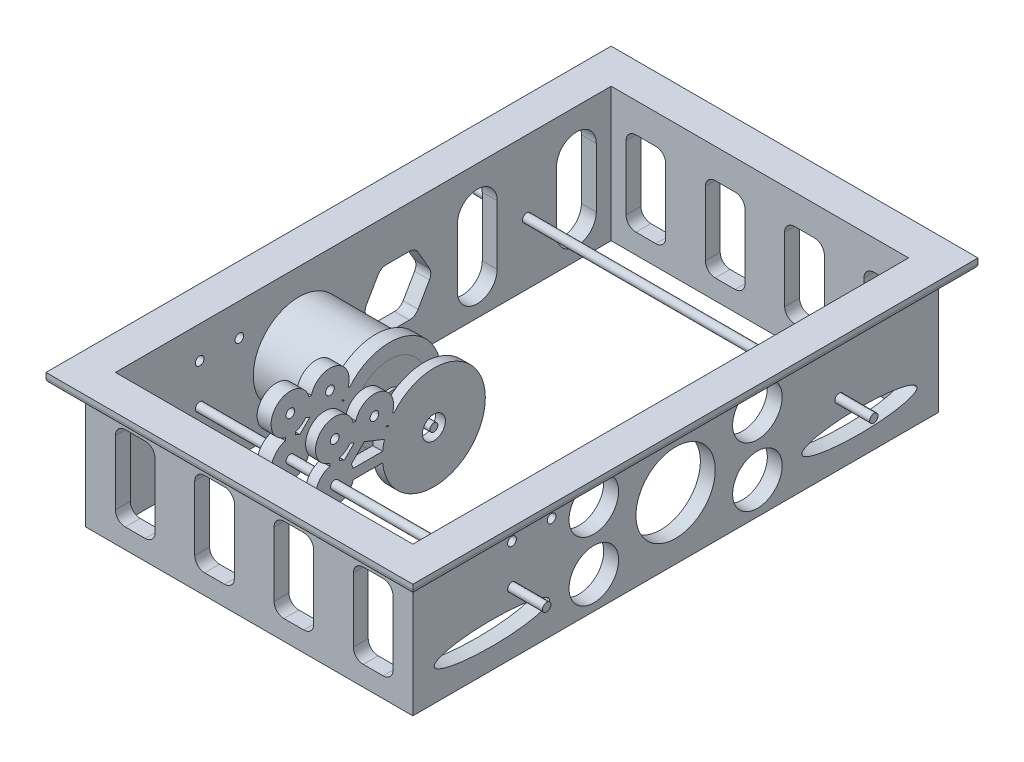
from build123d import *

# Parameters (mm, degrees)
SKETCH3_W             = 83.82
SKETCH3_H             = 134.62
SKETCH3_W_2           = 76.2
SKETCH3_H_2           = 127
EXTRUDE_THIN1_DEPTH   = 31.75
SKETCH6_R             = 1.1176
CUT_EXTRUDE1_DEPTH    = 159.57210032
SKETCH7_R             = 1.0795
BOSS_EXTRUDE1_DEPTH   = 50.8
BOSS_EXTRUDE1_2_DEPTH = 50.8
SKETCH9_R             = 11.6713
CUT_EXTRUDE2_DEPTH    = 3.81
SKETCH11_R            = 11.6713
BOSS_EXTRUDE2_DEPTH   = 23.4442
SKETCH12_R            = 9.3726
BOSS_EXTRUDE3_DEPTH   = 3.5814
SKETCH13_R            = 2.9464
BOSS_EXTRUDE4_DEPTH   = 0.7366
SKETCH14_R            = 1.0287
BOSS_EXTRUDE5_DEPTH   = 10.6426
SKETCH16_R            = 1.0795
SKETCH16_R_2          = 9.3726
SKETCH16_R_3          = 1.1176
BOSS_EXTRUDE6_DEPTH   = 3.5814
SKETCH17_R            = 1.1176
CUT_EXTRUDE3_DEPTH    = 164.445595536
SKETCH19_R            = 2.9464
SKETCH19_R_2          = 1.0795
SKETCH19_R_3          = 1.1176
BOSS_EXTRUDE7_DEPTH   = 2.54
SKETCH20_R            = 10.16
SKETCH20_R_2          = 6.35
SKETCH20_RX           = 14.75866049
SKETCH20_RY           = 2.956893509
CUT_EXTRUDE4_DEPTH    = 3.81
CUT_EXTRUDE5_DEPTH    = 3.81
SKETCH22_W            = 10.16
SKETCH22_H            = 21.59
CUT_EXTRUDE6_DEPTH    = 3.81
SKETCH24_W            = 93.98
SKETCH24_H            = 144.78
SKETCH24_W_2          = 76.2
SKETCH24_H_2          = 127
BOSS_EXTRUDE9_DEPTH   = 2.54
FILLET1_R             = 2.54
FILLET2_R             = 1.27


with BuildPart() as part:
    # Sketch3 → Extrude-Thin1 (new body)
    with BuildSketch(Plane(origin=(0, 0, 0), x_dir=(1, 0, 0), z_dir=(0, 1, 0))):
        with Locations((38.1, 63.5)):
            Rectangle(SKETCH3_W, SKETCH3_H)
        with Locations((38.1, 63.5)):
            Rectangle(SKETCH3_W_2, SKETCH3_H_2, mode=Mode.SUBTRACT)
    extrude(amount=EXTRUDE_THIN1_DEPTH)

    # Sketch6 → Cut-Extrude1 (cut, through all)
    with BuildSketch(Plane.ZY.offset(3.81)):
        with Locations((-21.59, 15.875)):
            Circle(SKETCH6_R)
        with Locations((-105.41, 15.875)):
            Circle(SKETCH6_R)
    extrude(amount=-CUT_EXTRUDE1_DEPTH, mode=Mode.SUBTRACT)

    # Sketch9 → Cut-Extrude2 (cut)
    with BuildSketch(Plane.ZY.offset(3.81)):
        with Locations((-46.99, 15.875)):
            Circle(SKETCH9_R)
    extrude(amount=-CUT_EXTRUDE2_DEPTH, mode=Mode.SUBTRACT)

    # Sketch17 → Cut-Extrude3 (cut, through all)
    with BuildSketch(Plane(origin=(80.01, 0, 0), x_dir=(0, 0, -1), z_dir=(1, 0, 0))):
        with Locations((21.59, 26.035)):
            Circle(SKETCH17_R)
        with Locations((31.75, 26.035)):
            Circle(SKETCH17_R)
    extrude(amount=-CUT_EXTRUDE3_DEPTH, mode=Mode.SUBTRACT)

    # Sketch20 → Cut-Extrude4 (cut)
    with BuildSketch(Plane(origin=(80.01, 0, 0), x_dir=(0, 0, -1), z_dir=(1, 0, 0))):
        with Locations((63.5, 15.875)):
            Circle(SKETCH20_R)
        with Locations((84.455, 23.495)):
            Circle(SKETCH20_R_2)
        with Locations(Location((42.545, 23.495, 0), (0, 0, 180))):
            Circle(SKETCH20_R_2)
        with Locations((42.545, 8.255)):
            Circle(SKETCH20_R_2)
        with Locations(Location((84.455, 8.255, 0), (0, 0, 180))):
            Circle(SKETCH20_R_2)
        with Locations((16.421244345, 8.255)):
            Ellipse(SKETCH20_RX, SKETCH20_RY)
        with Locations(Location((110.578755655, 8.255), (0, 0, -180))):
            Ellipse(SKETCH20_RX, SKETCH20_RY)
    extrude(amount=-CUT_EXTRUDE4_DEPTH, mode=Mode.SUBTRACT)

    # Sketch21 → Cut-Extrude5 (cut)
    with BuildSketch(Plane.ZY.offset(3.81)):
        with BuildLine():
            Line((-123.19, 8.255), (-123.19, 23.495))
            ThreePointArc((-123.19, 23.495), (-118.11, 28.575), (-113.03, 23.495))
            Line((-113.03, 23.495), (-113.03, 8.255))
            ThreePointArc((-113.03, 8.255), (-118.11, 3.175), (-123.19, 8.255))
        make_face()
        with BuildLine():
            Line((-87.63, 8.255), (-87.63, 23.495))
            ThreePointArc((-87.63, 23.495), (-92.71, 28.575), (-97.79, 23.495))
            Line((-97.79, 23.495), (-97.79, 8.255))
            ThreePointArc((-97.79, 8.255), (-92.71, 3.175), (-87.63, 8.255))
        make_face()
        Polygon((-67.990590949, 23.495), (-76.789409051, 23.495), (-81.188818102, 15.875), (-76.789409051, 8.255), (-67.990590949, 8.255), (-63.591181898, 15.875), align=None)
    extrude(amount=-CUT_EXTRUDE5_DEPTH, mode=Mode.SUBTRACT)

    # Sketch22 → Cut-Extrude6 (cut)
    with BuildSketch(Plane(origin=(0, 0, -130.81), x_dir=(-1, 0, 0), z_dir=(0, 0, -1))):
        with Locations((-69.85, 15.875)):
            Rectangle(SKETCH22_W, SKETCH22_H)
        with Locations((-49.53, 15.875)):
            Rectangle(SKETCH22_W, SKETCH22_H)
        with Locations((-29.21, 15.875)):
            Rectangle(SKETCH22_W, SKETCH22_H)
        with Locations((-8.89, 15.875)):
            Rectangle(SKETCH22_W, SKETCH22_H)
    cut_extrude6 = extrude(amount=-CUT_EXTRUDE6_DEPTH, mode=Mode.SUBTRACT)

    # Mirror2: Cut-Extrude6 across plane
    add(cut_extrude6.mirror(Plane(origin=(0, 0, -63.5), x_dir=(1, 0, 0), z_dir=(0, 0, -1))), mode=Mode.SUBTRACT)

    # Sketch24 → Boss-Extrude9 (add)
    with BuildSketch(Plane(origin=(0, 31.75, 0), x_dir=(1, 0, 0), z_dir=(0, 1, 0))):
        with Locations((38.1, 63.5)):
            Rectangle(SKETCH24_W, SKETCH24_H)
        with Locations((38.1, 63.5)):
            Rectangle(SKETCH24_W_2, SKETCH24_H_2, mode=Mode.SUBTRACT)
    extrude(amount=BOSS_EXTRUDE9_DEPTH)

    # Fillet1
    fillet1_edges = [part.edges().sort_by_distance(p)[0] for p in [
        (80.01, 31.75, -63.5),
        (-1.905, 8.255, -76.789409051),
        (-1.905, 15.875, -81.188818102),
        (-1.905, 23.495, -67.990590949),
        (-1.905, 15.875, -63.591181898),
        (-1.905, 8.255, -67.990590949),
        (-1.905, 23.495, -76.789409051),
        (38.1, 31.75, -130.81),
        (64.77, 26.67, -128.905),
        (74.93, 26.67, -128.905),
        (74.93, 5.08, -128.905),
        (64.77, 5.08, -128.905),
        (44.45, 26.67, -128.905),
        (54.61, 26.67, -128.905),
        (54.61, 5.08, -128.905),
        (44.45, 5.08, -128.905),
        (24.13, 26.67, -128.905),
        (34.29, 26.67, -128.905),
        (34.29, 5.08, -128.905),
        (24.13, 5.08, -128.905),
        (3.81, 26.67, -128.905),
        (13.97, 26.67, -128.905),
        (13.97, 5.08, -128.905),
        (3.81, 5.08, -128.905),
        (74.93, 5.08, 1.905),
        (64.77, 5.08, 1.905),
        (64.77, 26.67, 1.905),
        (74.93, 26.67, 1.905),
        (54.61, 5.08, 1.905),
        (44.45, 5.08, 1.905),
        (44.45, 26.67, 1.905),
        (54.61, 26.67, 1.905),
        (34.29, 5.08, 1.905),
        (24.13, 5.08, 1.905),
        (24.13, 26.67, 1.905),
        (34.29, 26.67, 1.905),
        (13.97, 5.08, 1.905),
        (3.81, 5.08, 1.905),
        (3.81, 26.67, 1.905),
        (13.97, 26.67, 1.905),
        (-3.81, 31.75, -63.5),
        (38.1, 31.75, 3.81),
    ]]
    fillet(fillet1_edges, radius=FILLET1_R)

    # Fillet2
    fillet2_edges = [part.edges().sort_by_distance(p)[0] for p in [
        (-8.89, 31.75, -63.5),
        (38.1, 31.75, 8.89),
        (85.09, 31.75, -63.5),
        (38.1, 31.75, -135.89),
    ]]
    fillet(fillet2_edges, radius=FILLET2_R)


with BuildPart() as body_2:
    # Sketch7 → Boss-Extrude1 (new, symmetric)
    with BuildSketch(Plane.ZY.offset(-38.1)):
        with Locations((-21.59, 15.875)):
            Circle(SKETCH7_R)
    extrude(amount=BOSS_EXTRUDE1_DEPTH, both=True)


with BuildPart() as body_3:
    # Sketch7 → Boss-Extrude1 2 (new, symmetric)
    with BuildSketch(Plane.ZY.offset(-38.1)):
        with Locations((-105.41, 15.875)):
            Circle(SKETCH7_R)
    extrude(amount=BOSS_EXTRUDE1_2_DEPTH, both=True)


with BuildPart() as body_4:
    # Sketch11 → Boss-Extrude2 (new body)
    with BuildSketch(Plane.ZY.offset(3.81)):
        with Locations((-46.99, 15.875)):
            Circle(SKETCH11_R)
    extrude(amount=-BOSS_EXTRUDE2_DEPTH)

    # Sketch12 → Boss-Extrude3 (add)
    with BuildSketch(Plane(origin=(19.6342, 0, 0), x_dir=(0, 0, -1), z_dir=(1, 0, 0))):
        with Locations((46.99, 15.875)):
            Circle(SKETCH12_R)
    extrude(amount=BOSS_EXTRUDE3_DEPTH)

    # Sketch13 → Boss-Extrude4 (add)
    with BuildSketch(Plane(origin=(23.2156, 0, 0), x_dir=(0, 0, -1), z_dir=(1, 0, 0))):
        with Locations((46.99, 15.875)):
            Circle(SKETCH13_R)
    extrude(amount=BOSS_EXTRUDE4_DEPTH)

    # Sketch14 → Boss-Extrude5 (add)
    with BuildSketch(Plane(origin=(23.9522, 0, 0), x_dir=(0, 0, -1), z_dir=(1, 0, 0))):
        with Locations((46.99, 15.875)):
            Circle(SKETCH14_R)
    extrude(amount=BOSS_EXTRUDE5_DEPTH)


with BuildPart() as body_5:
    # Sketch16 → Boss-Extrude6 (new body)
    with BuildSketch(Plane(origin=(19.6342, 0, 0), x_dir=(0, 0, -1), z_dir=(1, 0, 0))):
        with BuildLine():
            ThreePointArc((20.32, 20.596685107), (18.132601393, 12.417601393), (26.311685107, 14.605))
            Line((26.311685107, 14.605), (33.868717945, 14.605))
            ThreePointArc((33.868717945, 14.605), (59.606961348, 12.054891481), (36.776902653, 24.210081604))
            Line((36.776902653, 24.210081604), (36.415967371, 24.450705126))
            ThreePointArc((36.415967371, 24.450705126), (33.177940371, 30.75116667), (26.988871798, 27.305))
            Line((26.988871798, 27.305), (26.351128202, 27.305))
            ThreePointArc((26.351128202, 27.305), (18.105660625, 29.519339375), (20.32, 21.273871798))
            Line((20.32, 21.273871798), (20.32, 20.596685107))
        make_face()
        with Locations((21.59, 15.875)):
            Circle(SKETCH16_R, mode=Mode.SUBTRACT)
        with Locations((46.99, 15.875)):
            Circle(SKETCH16_R_2, mode=Mode.SUBTRACT)
        with BuildLine():
            Line((26.587226368, 22.668277592), (24.030709946, 20.11176117))
            ThreePointArc((24.030709946, 20.11176117), (23.461130643, 20.392308974), (22.86, 20.596685107))
            Line((22.86, 20.596685107), (22.86, 21.273871798))
            ThreePointArc((22.86, 21.273871798), (24.352554521, 21.954615915), (25.538930399, 23.087595979))
            Line((25.538930399, 23.087595979), (26.587226368, 22.668277592))
        make_face(mode=Mode.SUBTRACT)
        with BuildLine():
            Line((25.82676117, 18.315709946), (29.153013831, 21.641962607))
            Line((29.153013831, 21.641962607), (34.335529299, 19.56895642))
            ThreePointArc((34.335529299, 19.56895642), (34.045261736, 18.367928808), (33.868717945, 17.145))
            Line((33.868717945, 17.145), (26.311685107, 17.145))
            ThreePointArc((26.311685107, 17.145), (26.107308974, 17.746130643), (25.82676117, 18.315709946))
        make_face(mode=Mode.SUBTRACT)
        with Locations((21.59, 26.035)):
            Circle(SKETCH16_R_3, mode=Mode.SUBTRACT)
        with BuildLine():
            Line((35.278861617, 21.927287214), (34.761075357, 22.134401718))
            ThreePointArc((34.761075357, 22.134401718), (34.885693595, 22.233859719), (35.007028873, 22.337297378))
            Line((35.007028873, 22.337297378), (35.367964155, 22.096673857))
            ThreePointArc((35.367964155, 22.096673857), (35.323105475, 22.012142243), (35.278861617, 21.927287214))
        make_face(mode=Mode.SUBTRACT)
        with Locations((31.75, 26.035)):
            Circle(SKETCH16_R_3, mode=Mode.SUBTRACT)
    extrude(amount=BOSS_EXTRUDE6_DEPTH)


with BuildPart() as body_6:
    # Sketch19 → Boss-Extrude7 (new body)
    with BuildSketch(Plane(origin=(34.5948, 0, 0), x_dir=(0, 0, -1), z_dir=(1, 0, 0))):
        with BuildLine():
            Line((26.988871798, 27.305), (26.351128202, 27.305))
            ThreePointArc((26.351128202, 27.305), (18.105660625, 29.519339375), (20.32, 21.273871798))
            Line((20.32, 21.273871798), (20.32, 20.596685107))
            ThreePointArc((20.32, 20.596685107), (18.132601393, 12.417601393), (26.311685107, 14.605))
            Line((26.311685107, 14.605), (33.868717945, 14.605))
            ThreePointArc((33.868717945, 14.605), (59.606961348, 12.054891481), (36.776902653, 24.210081604))
            Line((36.776902653, 24.210081604), (36.415967371, 24.450705126))
            ThreePointArc((36.415967371, 24.450705126), (33.177940371, 30.75116667), (26.988871798, 27.305))
        make_face()
        with Locations((46.99, 15.875)):
            Circle(SKETCH19_R, mode=Mode.SUBTRACT)
        with Locations((21.59, 15.875)):
            Circle(SKETCH19_R_2, mode=Mode.SUBTRACT)
        with Locations((21.59, 26.035)):
            Circle(SKETCH19_R_3, mode=Mode.SUBTRACT)
        with Locations((31.75, 26.035)):
            Circle(SKETCH19_R_3, mode=Mode.SUBTRACT)
        with BuildLine():
            Line((29.153013831, 21.641962607), (34.335529299, 19.56895642))
            ThreePointArc((34.335529299, 19.56895642), (34.045261736, 18.367928808), (33.868717945, 17.145))
            Line((33.868717945, 17.145), (26.311685107, 17.145))
            ThreePointArc((26.311685107, 17.145), (26.107308974, 17.746130643), (25.82676117, 18.315709946))
            Line((25.82676117, 18.315709946), (29.153013831, 21.641962607))
        make_face(mode=Mode.SUBTRACT)
        with BuildLine():
            Line((25.538930399, 23.087595979), (26.587226368, 22.668277592))
            Line((26.587226368, 22.668277592), (24.030709946, 20.11176117))
            ThreePointArc((24.030709946, 20.11176117), (23.461130643, 20.392308974), (22.86, 20.596685107))
            Line((22.86, 20.596685107), (22.86, 21.273871798))
            ThreePointArc((22.86, 21.273871798), (24.352554521, 21.954615915), (25.538930399, 23.087595979))
        make_face(mode=Mode.SUBTRACT)
        with BuildLine():
            Line((34.761075357, 22.134401718), (35.278861617, 21.927287214))
            ThreePointArc((35.278861617, 21.927287214), (35.323105475, 22.012142243), (35.367964155, 22.096673857))
            Line((35.367964155, 22.096673857), (35.007028873, 22.337297378))
            ThreePointArc((35.007028873, 22.337297378), (34.885693595, 22.233859719), (34.761075357, 22.134401718))
        make_face(mode=Mode.SUBTRACT)
    extrude(amount=-BOSS_EXTRUDE7_DEPTH)


solid = Compound([part.part, body_2.part, body_3.part, body_4.part, body_5.part, body_6.part])
